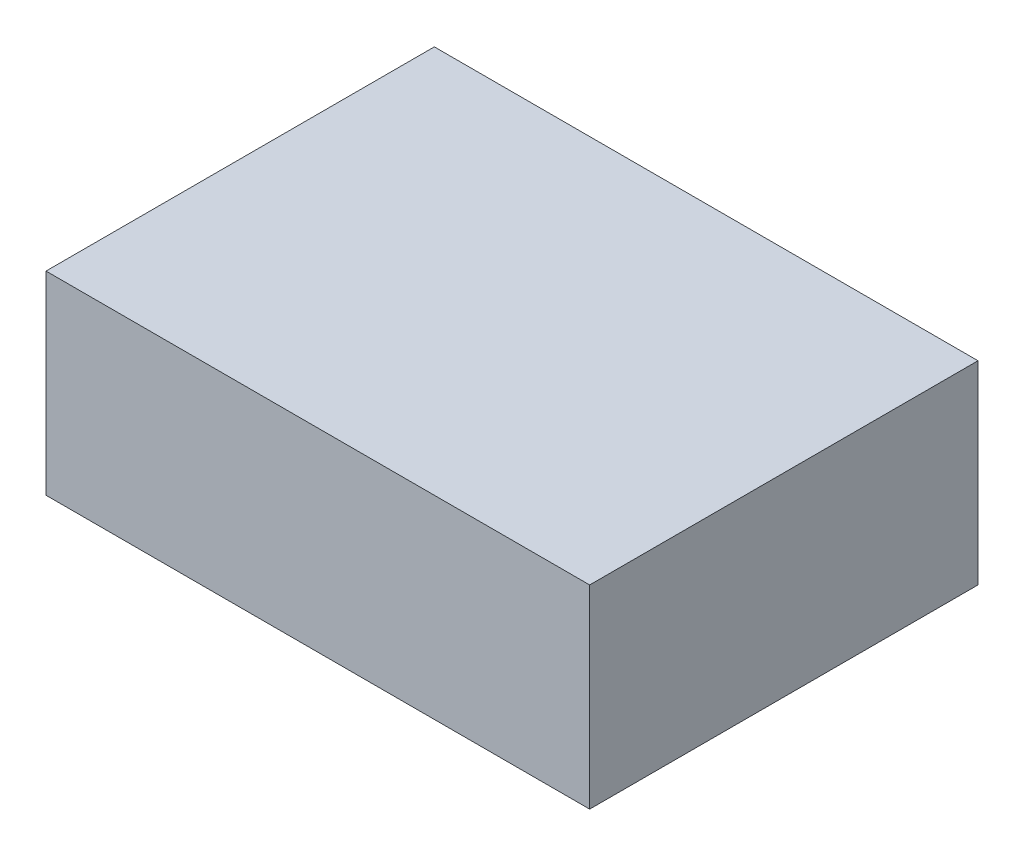
from build123d import *

# Parameters (mm, degrees)
SKETCH_1_W      = 5.6
SKETCH_1_H      = 4
EXTRUDE_1_DEPTH = 2


with BuildPart() as part:
    # Эскиз1 → Бобышка-Вытянуть1 (new body)
    with BuildSketch(Plane(origin=(0, 0, 0), x_dir=(1, 0, 0), z_dir=(0, 1, 0))):
        with Locations((2.8, 2)):
            Rectangle(SKETCH_1_W, SKETCH_1_H)
    extrude(amount=EXTRUDE_1_DEPTH)


solid = part.part
